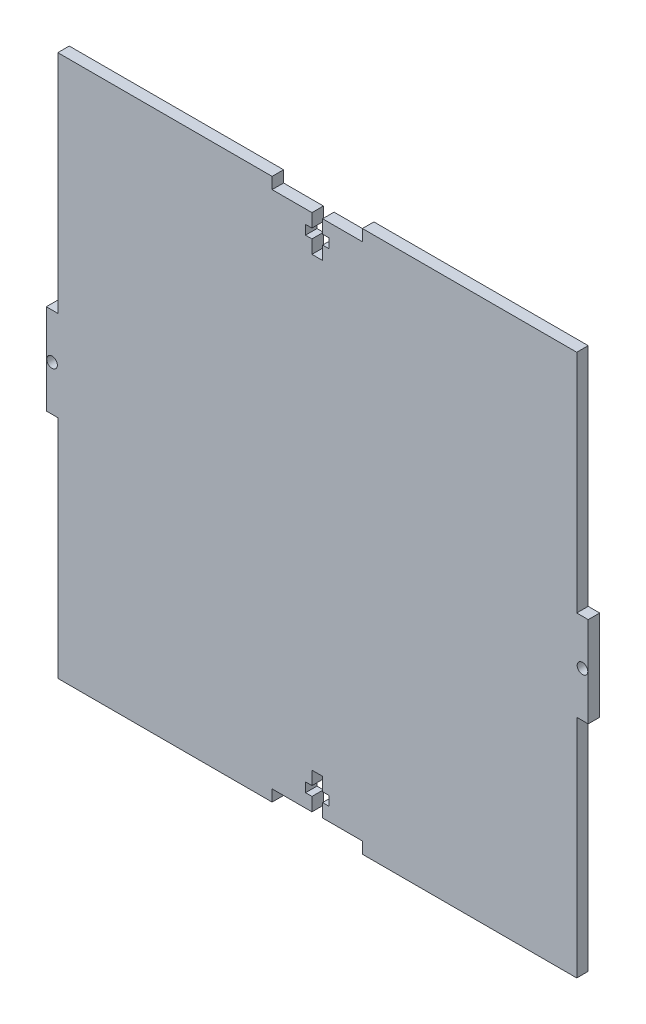
from build123d import *

# Parameters (mm, degrees)
SKETCH1_R           = 1.47
BOSS_EXTRUDE1_DEPTH = 1.5875


with BuildPart() as part:
    # Sketch1 → Boss-Extrude1 (new, symmetric)
    with BuildSketch(Plane.XY):
        Polygon((-12.5, 75), (-71.825, 75), (-71.825, 12.5), (-75, 12.5), (-75, -12.5), (-71.825, -12.5), (-71.825, -75), (-12.5, -75), (-12.5, -71.825), (-1.47, -71.825), (-1.47, -68.125), (-3.25, -68.125), (-3.25, -65.525), (-1.47, -65.525), (-1.47, -61.825), (1.47, -61.825), (1.47, -65.525), (3.25, -65.525), (3.25, -68.125), (1.47, -68.125), (1.47, -71.825), (12.5, -71.825), (12.5, -75), (71.825, -75), (71.825, -12.5), (75, -12.5), (75, 12.5), (71.825, 12.5), (71.825, 75), (12.5, 75), (12.5, 71.825), (1.47, 71.825), (1.47, 68.125), (3.25, 68.125), (3.25, 65.525), (1.47, 65.525), (1.47, 61.825), (-1.47, 61.825), (-1.47, 65.525), (-3.25, 65.525), (-3.25, 68.125), (-1.47, 68.125), (-1.47, 71.825), (-12.5, 71.825), align=None)
        with Locations((-73.4125, 0)):
            Circle(SKETCH1_R, mode=Mode.SUBTRACT)
        with Locations(Location((73.4125, 0, 0), (0, 0, 180))):
            Circle(SKETCH1_R, mode=Mode.SUBTRACT)
    extrude(amount=BOSS_EXTRUDE1_DEPTH, both=True)


solid = part.part
